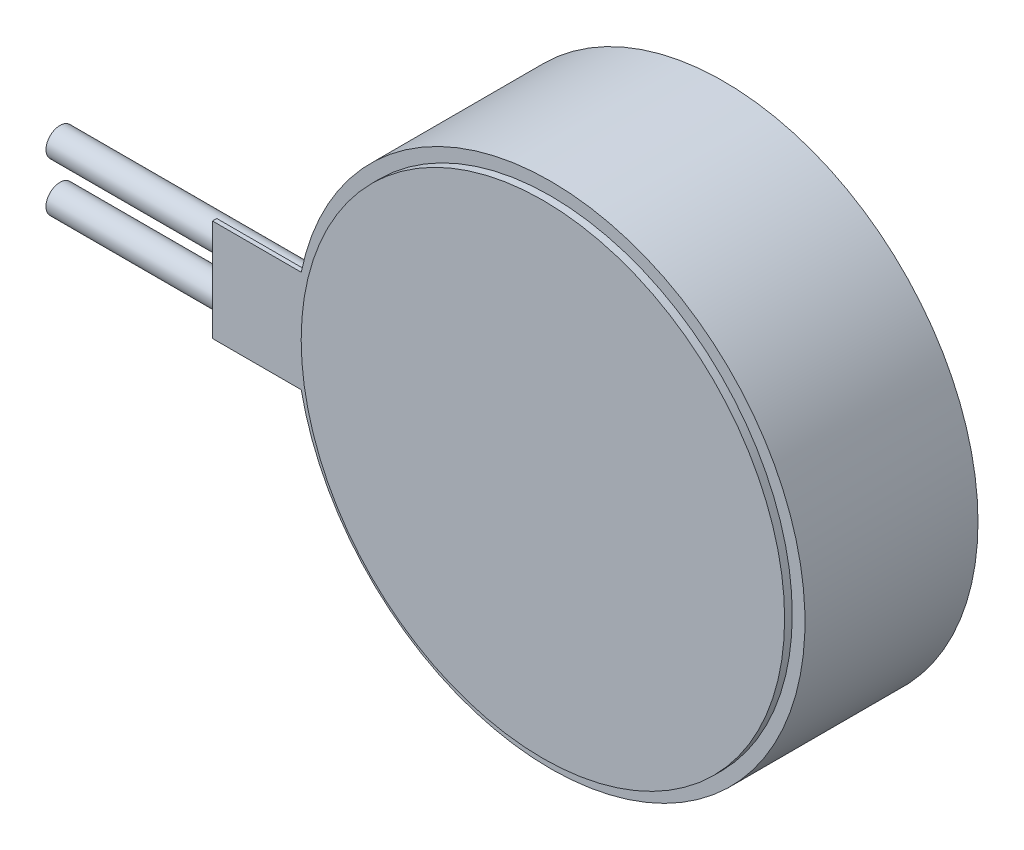
from build123d import *

# Parameters (mm, degrees)
SKETCH1_R             = 5
BOSS_EXTRUDE1_DEPTH   = 3.4
SKETCH2_R             = 4.75
BOSS_EXTRUDE2_DEPTH   = 0.15
BOSS_EXTRUDE3_START   = -0.085
BOSS_EXTRUDE3_DEPTH   = 0.085
SKETCH5_R             = 0.275
BOSS_EXTRUDE5_DEPTH   = 10
BOSS_EXTRUDE5_2_DEPTH = 10


with BuildPart() as part:
    # Sketch1 → Boss-Extrude1 (new body)
    with BuildSketch(Plane.XY):
        Circle(SKETCH1_R)
    extrude(amount=BOSS_EXTRUDE1_DEPTH)

    # Sketch2 → Boss-Extrude2 (add)
    with BuildSketch(Plane.XY.offset(3.4)):
        Circle(SKETCH2_R)
    extrude(amount=BOSS_EXTRUDE2_DEPTH)

    # Sketch4 → Boss-Extrude3 (add)
    with BuildSketch(Plane.XY.offset(3.4).offset(BOSS_EXTRUDE3_START)):
        with BuildLine():
            Line((-4.643543905, 1), (-6.643543905, 1))
            Line((-6.643543905, 1), (-6.643543905, -1))
            Line((-6.643543905, -1), (-4.643543905, -1))
            ThreePointArc((-4.643543905, -1), (-4.75, 0), (-4.643543905, 1))
        make_face()
    extrude(amount=BOSS_EXTRUDE3_DEPTH)


with BuildPart() as body_2:
    # Sketch5 → Boss-Extrude5 (new body)
    with BuildSketch(Plane(origin=(0, 0, 0), x_dir=(0, 0, -1), z_dir=(1, 0, 0))):
        with Locations((-3.04, 0.493364025)):
            Circle(SKETCH5_R)
    extrude(amount=-BOSS_EXTRUDE5_DEPTH)


with BuildPart() as body_3:
    # Sketch5 → Boss-Extrude5 2 (new body)
    with BuildSketch(Plane(origin=(0, 0, 0), x_dir=(0, 0, -1), z_dir=(1, 0, 0))):
        with Locations((-3.04, -0.475118647)):
            Circle(SKETCH5_R)
    extrude(amount=-BOSS_EXTRUDE5_2_DEPTH)


solid = Compound([part.part, body_2.part, body_3.part])
